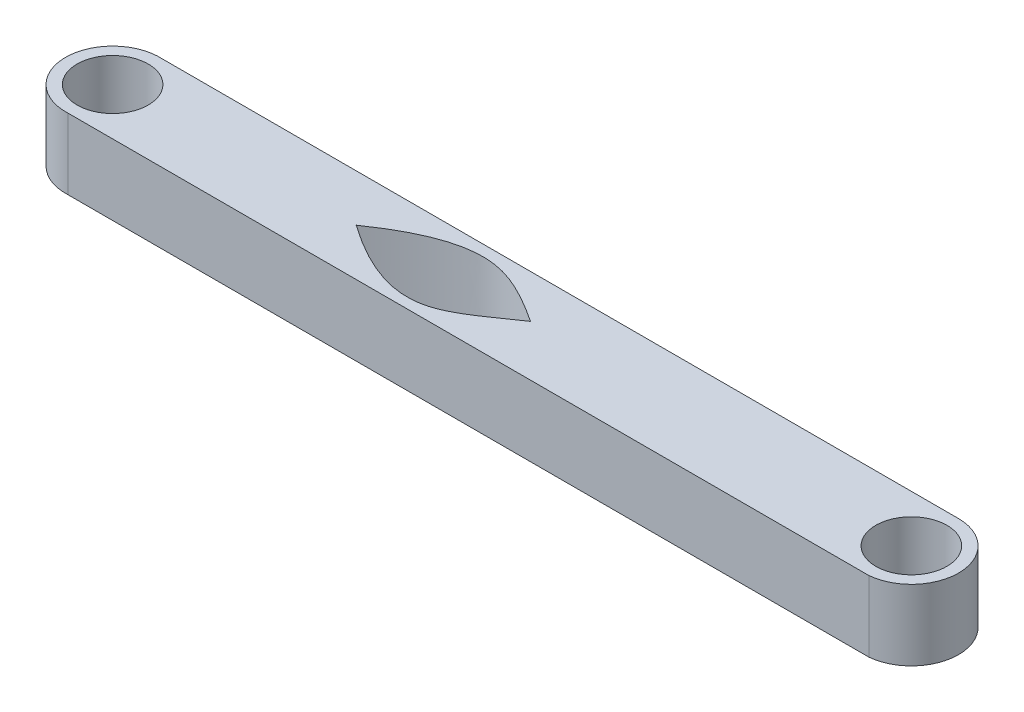
from build123d import *

# Parameters (mm, degrees)
SALIENTE_EXTRUIR1_DEPTH = 38.1
CORTAR_EXTRUIR18_DEPTH  = 38.1
CROQUIS4_OUTSIDE_W      = 580.479
CROQUIS4_OUTSIDE_H      = 149.876
CROQUIS4_OUTSIDE_R      = 19.177
CORTAR_EXTRUIR21_DEPTH  = 50.8


with BuildPart() as part:
    # Croquis1 → Saliente-Extruir1 (new body)
    with BuildSketch(Plane(origin=(0, 0, 0), x_dir=(1, 0, 0), z_dir=(0, 1, 0))):
        with BuildLine():
            Line((-61.958802083, 0), (369.841197917, 0))
            ThreePointArc((369.841197917, 0), (392.72185746, 26.5666935), (367.322364583, 50.7365))
            Line((367.322364583, 50.7365), (-64.477635417, 50.7365))
            ThreePointArc((-64.477635417, 50.7365), (-88.58646875, 24.108833333), (-61.958802083, 0))
        make_face()
    extrude(amount=SALIENTE_EXTRUIR1_DEPTH)

    # Croquis3 → Cortar-Extruir18 (cut)
    with BuildSketch(Plane(origin=(0, 38.1, 0), x_dir=(1, 0, 0), z_dir=(0, 1, 0))):
        with BuildLine():
            add(Edge.make_bspline(
                [(68.053382641, 25.36825), (85.128897701, 37.242607365), (117.715779547, 53.529246636), (147.710358419, 35.418129568), (159.94527156, 27.422727745)],
                knots=[0.293668056, 0.293668056, 0.293668056, 0.293668056, 0.509999468, 0.663692502, 0.663692502, 0.663692502, 0.663692502], degree=3))
            add(Edge.make_bspline(
                [(68.053382641, 25.36825), (85.297187869, 13.221681932), (118.362782549, -4.355831371), (146.208725565, 18.171330049), (158.923925731, 26.746070777), (159.94527156, 27.422727745)],
                knots=[0.293535528, 0.293535528, 0.293535528, 0.293535528, 0.509769313, 0.658147643, 0.671041491, 0.671041491, 0.671041491, 0.671041491], degree=3))
        make_face()
    extrude(amount=-CORTAR_EXTRUIR18_DEPTH, mode=Mode.SUBTRACT)

    # Croquis4 outside → Cortar-Extruir21 (cut)
    # profile 1 of 3: a face of its own
    with BuildSketch(Plane(origin=(0, 38.1, 0), x_dir=(1, 0, 0), z_dir=(0, 1, 0))):
        with Locations((152.0675, 25.353)):
            Rectangle(CROQUIS4_OUTSIDE_W, CROQUIS4_OUTSIDE_H)
        with BuildLine():
            Line((-64.477635417, 50.7365), (367.322364583, 50.7365))
            ThreePointArc((367.322364583, 50.7365), (392.72185746, 26.5666935), (369.841197917, 0))
            Line((369.841197917, 0), (-61.958802083, 0))
            ThreePointArc((-61.958802083, 0), (-88.58646875, 24.108833333), (-64.477635417, 50.7365))
        make_face(mode=Mode.SUBTRACT)
    # profile 2 of 3: a face of its own
    with BuildSketch(Plane(origin=(0, 38.1, 0), x_dir=(1, 0, 0), z_dir=(0, 1, 0))):
        with Locations(Location((-63.21821875, 25.36825, 0), (0, 0, 270))):
            Circle(CROQUIS4_OUTSIDE_R)
    # profile 3 of 3: a face of its own
    with BuildSketch(Plane(origin=(0, 38.1, 0), x_dir=(1, 0, 0), z_dir=(0, 1, 0))):
        with Locations(Location((367.322364583, 25.305725768, 0), (0, 0, 270))):
            Circle(CROQUIS4_OUTSIDE_R)
    extrude(amount=-CORTAR_EXTRUIR21_DEPTH, mode=Mode.SUBTRACT)


solid = part.part
